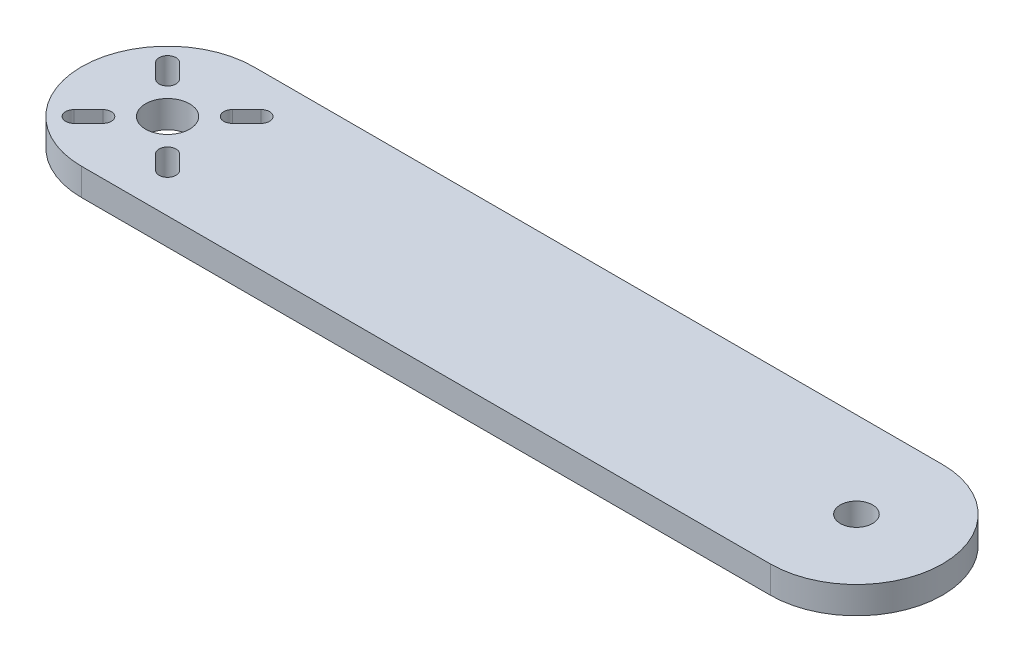
from build123d import *

# Parameters (mm, degrees)
SKETCH1_R           = 3.25
SKETCH1_R_2         = 2.38125
BOSS_EXTRUDE1_DEPTH = 4


with BuildPart() as part:
    # Sketch1 → Boss-Extrude1 (new body)
    with BuildSketch(Plane(origin=(0, 0, 0), x_dir=(1, 0, 0), z_dir=(0, 1, 0))):
        with BuildLine():
            Line((-50.8, 12.7), (50.8, 12.7))
            ThreePointArc((50.8, 12.7), (63.5, 0), (50.8, -12.7))
            Line((50.8, -12.7), (-50.8, -12.7))
            ThreePointArc((-50.8, -12.7), (-63.5, 0), (-50.8, 12.7))
        make_face()
        with Locations(Location((-50.8, 0, 0), (0, 0, 270))):
            Circle(SKETCH1_R, mode=Mode.SUBTRACT)
        with Locations(Location((50.8, 0, 0), (0, 0, 270))):
            Circle(SKETCH1_R_2, mode=Mode.SUBTRACT)
        with BuildLine():
            Line((-56.81040764, 7.778174593), (-54.689087297, 5.656854249))
            ThreePointArc((-54.689087297, 5.656854249), (-54.689087297, 3.889087297), (-56.456854249, 3.889087297))
            Line((-56.456854249, 3.889087297), (-58.578174593, 6.01040764))
            ThreePointArc((-58.578174593, 6.01040764), (-58.578174593, 7.778174593), (-56.81040764, 7.778174593))
        make_face(mode=Mode.SUBTRACT)
        with BuildLine():
            Line((-43.021825407, 6.01040764), (-45.143145751, 3.889087297))
            ThreePointArc((-45.143145751, 3.889087297), (-46.910912703, 3.889087297), (-46.910912703, 5.656854249))
            Line((-46.910912703, 5.656854249), (-44.78959236, 7.778174593))
            ThreePointArc((-44.78959236, 7.778174593), (-43.021825407, 7.778174593), (-43.021825407, 6.01040764))
        make_face(mode=Mode.SUBTRACT)
        with BuildLine():
            Line((-44.78959236, -7.778174593), (-46.910912703, -5.656854249))
            ThreePointArc((-46.910912703, -5.656854249), (-46.910912703, -3.889087297), (-45.143145751, -3.889087297))
            Line((-45.143145751, -3.889087297), (-43.021825407, -6.01040764))
            ThreePointArc((-43.021825407, -6.01040764), (-43.021825407, -7.778174593), (-44.78959236, -7.778174593))
        make_face(mode=Mode.SUBTRACT)
        with BuildLine():
            Line((-58.578174593, -6.01040764), (-56.456854249, -3.889087297))
            ThreePointArc((-56.456854249, -3.889087297), (-54.689087297, -3.889087297), (-54.689087297, -5.656854249))
            Line((-54.689087297, -5.656854249), (-56.81040764, -7.778174593))
            ThreePointArc((-56.81040764, -7.778174593), (-58.578174593, -7.778174593), (-58.578174593, -6.01040764))
        make_face(mode=Mode.SUBTRACT)
    extrude(amount=BOSS_EXTRUDE1_DEPTH)


solid = part.part
